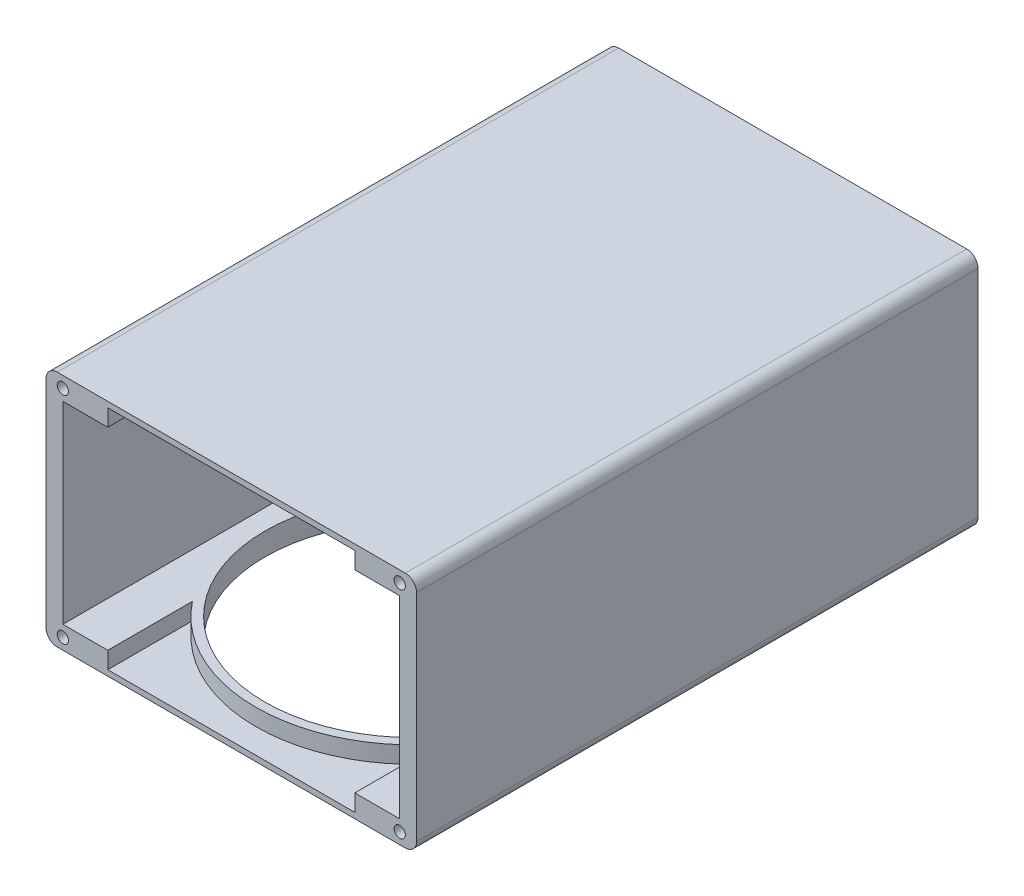
from build123d import *

# Parameters (mm, degrees)
BOSS_EXTRUDE3_DEPTH   = 250
BOSS_EXTRUDE3_2_DEPTH = 250
FILLET1_R             = 5
FILLET2_R             = 5
SKETCH7_R             = 66
CUT_EXTRUDE1_DEPTH    = 10
SKETCH9_R             = 70
SKETCH9_R_2           = 66
BOSS_EXTRUDE4_DEPTH   = 8
SKETCH14_R            = 2.5
CUT_EXTRUDE2_DEPTH    = 12
CUT_EXTRUDE3_START    = -12
SKETCH15_R            = 2.5
CUT_EXTRUDE3_DEPTH    = 12
SKETCH17_W            = 7.5
SKETCH17_H            = 250
BOSS_EXTRUDE5_DEPTH   = 46


with BuildPart() as part:
    # Sketch4 → Boss-Extrude3 (new body)
    with BuildSketch(Plane.XY):
        Polygon((130, 93.5), (130, 86), (150, 86), (150, 66), (155, 66), (157.5, 66), (157.5, 96), (-7.5, 96), (-7.5, 66), (-5, 66), (0, 66), (0, 86), (20, 86), (20, 93.5), align=None)
    extrude(amount=-BOSS_EXTRUDE3_DEPTH)

    # Fillet1
    fillet1_edges = [part.edges().sort_by_distance(p)[0] for p in [
        (-7.5, 96, -125),
        (157.5, 96, -125),
    ]]
    fillet(fillet1_edges, radius=FILLET1_R)


with BuildPart() as body_2:
    # Sketch4 → Boss-Extrude3 2 (new body)
    with BuildSketch(Plane.XY):
        Polygon((155, 20), (150, 20), (150, 0), (130, 0), (130, -7.5), (20, -7.5), (20, 0), (0, 0), (0, 20), (-5, 20), (-7.5, 20), (-7.5, 0), (-7.5, -10), (157.5, -10), (157.5, 20), align=None)
    extrude(amount=-BOSS_EXTRUDE3_2_DEPTH)

    # Fillet2
    fillet2_edges = [body_2.edges().sort_by_distance(p)[0] for p in [
        (157.5, -10, -125),
        (-7.5, -10, -125),
    ]]
    fillet(fillet2_edges, radius=FILLET2_R)

    # Sketch7 → Cut-Extrude1 (cut)
    with BuildSketch(Plane(origin=(0, 0, 0), x_dir=(-1, 0, 0), z_dir=(0, -1, 0))):
        with Locations(Location((-75, 81, 0), (0, 0, 326.442690238))):
            Circle(SKETCH7_R)
    extrude(amount=CUT_EXTRUDE1_DEPTH, mode=Mode.SUBTRACT)

    # Sketch9 → Boss-Extrude4 (add)
    with BuildSketch(Plane.XZ):
        with Locations((75, -81)):
            Circle(SKETCH9_R)
        with Locations(Location((75, -81, 0), (0, 0, 270))):
            Circle(SKETCH9_R_2, mode=Mode.SUBTRACT)
    extrude(amount=BOSS_EXTRUDE4_DEPTH)


with BuildPart() as cut_extrude2_tool:
    # Sketch14 → Cut-Extrude2 (new body)
    with BuildSketch(Plane(origin=(0, 0, -250), x_dir=(-1, 0, 0), z_dir=(0, 0, -1))):
        with Locations((0, 91)):
            Circle(SKETCH14_R)
        with Locations(Location((-150, 91, 0), (0, 0, 180))):
            Circle(SKETCH14_R)
        with Locations(Location((0, -5, 0), (0, 0, 180))):
            Circle(SKETCH14_R)
        with Locations((-150, -5)):
            Circle(SKETCH14_R)
    extrude(amount=-CUT_EXTRUDE2_DEPTH)


with BuildPart() as part_1:
    add(part.part)

    # Cut-Extrude2: cut by cut_extrude2_tool
    add(cut_extrude2_tool.part, mode=Mode.SUBTRACT)


with BuildPart() as body_2_1:
    add(body_2.part)

    # Cut-Extrude2: cut by cut_extrude2_tool
    add(cut_extrude2_tool.part, mode=Mode.SUBTRACT)


with BuildPart() as cut_extrude3_tool:
    # Sketch15 → Cut-Extrude3 (new body)
    with BuildSketch(Plane.XY.offset(CUT_EXTRUDE3_START)):
        with Locations(Location((0, 91, 0), (0, 0, 180))):
            Circle(SKETCH15_R)
        with Locations((150, 91)):
            Circle(SKETCH15_R)
        with Locations(Location((150, -5, 0), (0, 0, 180))):
            Circle(SKETCH15_R)
        with Locations((0, -5)):
            Circle(SKETCH15_R)
    extrude(amount=CUT_EXTRUDE3_DEPTH)


with BuildPart() as part_2:
    add(part_1.part)

    # Cut-Extrude3: cut by cut_extrude3_tool
    add(cut_extrude3_tool.part, mode=Mode.SUBTRACT)



with BuildPart() as body_2_2:
    add(body_2_1.part)

    # Cut-Extrude3: cut by cut_extrude3_tool
    add(cut_extrude3_tool.part, mode=Mode.SUBTRACT)


with BuildPart() as part_3:
    add(part_2.part)

    add(body_2_2.part)  # Boss-Extrude5 merges body 2
    # Sketch17 → Boss-Extrude5 (add)
    with BuildSketch(Plane.XZ.offset(-66)):
        with Locations((-3.75, -125)):
            Rectangle(SKETCH17_W, SKETCH17_H)
        with Locations((153.75, -125)):
            Rectangle(SKETCH17_W, SKETCH17_H)
    extrude(amount=BOSS_EXTRUDE5_DEPTH)


solid = part_3.part
